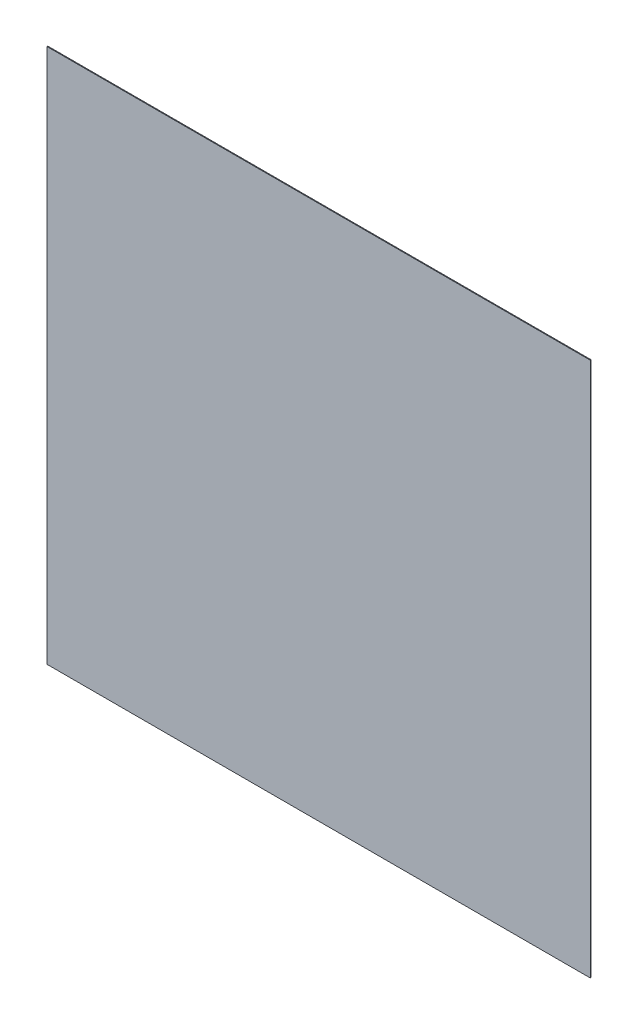
from build123d import *

# Parameters (mm, degrees)
CROQUIS1_W              = 1300
CROQUIS1_H              = 1280
SALIENTE_EXTRUIR1_DEPTH = 1.92


with BuildPart() as part:
    # Croquis1 → Saliente-Extruir1 (new body)
    with BuildSketch(Plane.XY):
        Rectangle(CROQUIS1_W, CROQUIS1_H)
    extrude(amount=SALIENTE_EXTRUIR1_DEPTH)


solid = part.part
